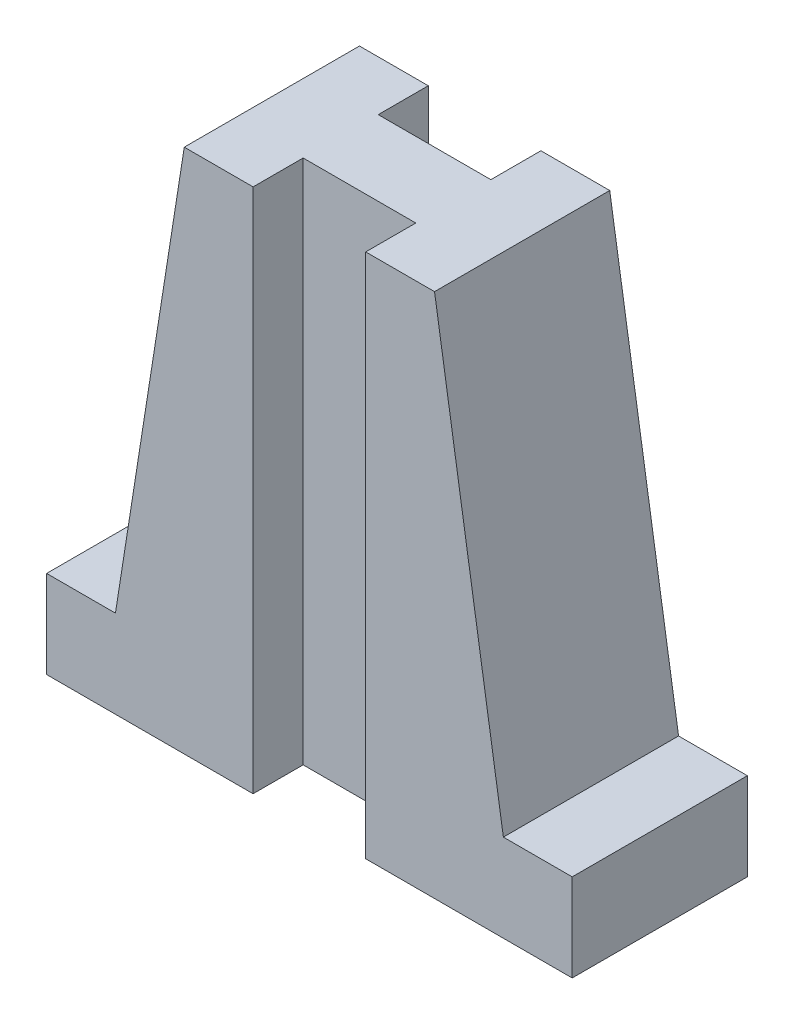
from build123d import *

# Parameters (mm, degrees)
SALIENTE_EXTRUIR1_DEPTH = 28
CROQUIS2_W              = 18
CROQUIS2_H              = 8
CORTAR_EXTRUIR1_DEPTH   = 99


with BuildPart() as part:
    # Croquis1 → Saliente-Extruir1 (new body)
    with BuildSketch(Plane.XY):
        Polygon((-20, 35), (20, 35), (31, -35), (42, -35), (42, -49), (-42, -49), (-42, -35), (-31, -35), align=None)
    extrude(amount=-SALIENTE_EXTRUIR1_DEPTH)

    # Croquis2 → Cortar-Extruir1 (cut, through all)
    with BuildSketch(Plane(origin=(0, 35, 0), x_dir=(1, 0, 0), z_dir=(0, 1, 0))):
        with Locations((0, 4)):
            Rectangle(CROQUIS2_W, CROQUIS2_H)
        with Locations((0, 24)):
            Rectangle(CROQUIS2_W, CROQUIS2_H)
    extrude(amount=-CORTAR_EXTRUIR1_DEPTH, mode=Mode.SUBTRACT)


solid = part.part
